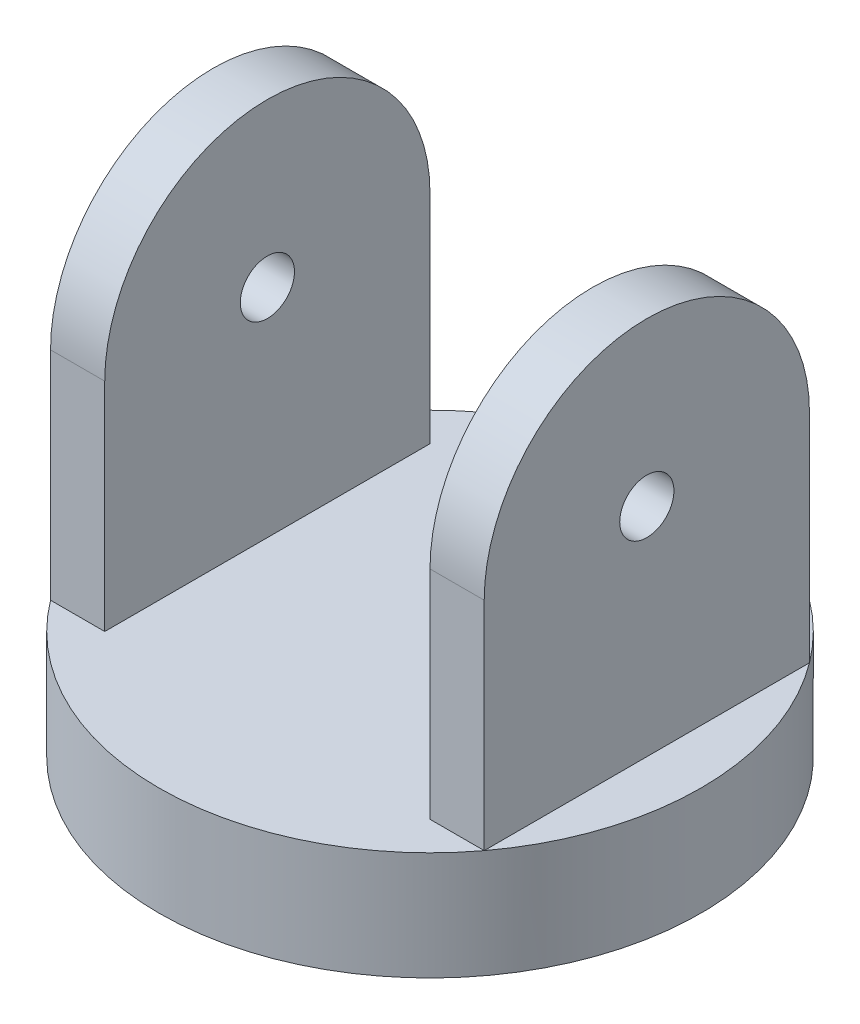
from build123d import *

# Parameters (mm, degrees)
SKETCH1_R           = 25
BOSS_EXTRUDE1_DEPTH = 10
SKETCH2_W           = 5
SKETCH2_H           = 30
BOSS_EXTRUDE2_DEPTH = 40
SKETCH3_R           = 2.5
CUT_EXTRUDE1_DEPTH  = 72.763500472


with BuildPart() as part:
    # Sketch1 → Boss-Extrude1 (new body)
    with BuildSketch(Plane(origin=(0, 0, 0), x_dir=(1, 0, 0), z_dir=(0, 1, 0))):
        with Locations(Location((0, 0, 0), (0, 0, 270))):
            Circle(SKETCH1_R)
    extrude(amount=BOSS_EXTRUDE1_DEPTH)

    # Sketch2 → Boss-Extrude2 (add)
    with BuildSketch(Plane(origin=(0, 10, 0), x_dir=(1, 0, 0), z_dir=(0, 1, 0))):
        with Locations((17.5, 0)):
            Rectangle(SKETCH2_W, SKETCH2_H)
        with Locations((-17.5, 0)):
            Rectangle(SKETCH2_W, SKETCH2_H)
    extrude(amount=BOSS_EXTRUDE2_DEPTH)

    # Sketch3 → Cut-Extrude1 (cut, through all)
    with BuildSketch(Plane.ZY.offset(20)):
        with BuildLine():
            Line((-15, 50), (-15, 30))
            ThreePointArc((-15, 30), (0, 45), (15, 30))
            Line((15, 30), (15, 50))
            Line((15, 50), (-15, 50))
        make_face()
        with Locations((0, 30)):
            Circle(SKETCH3_R)
    extrude(amount=-CUT_EXTRUDE1_DEPTH, mode=Mode.SUBTRACT)


solid = part.part
